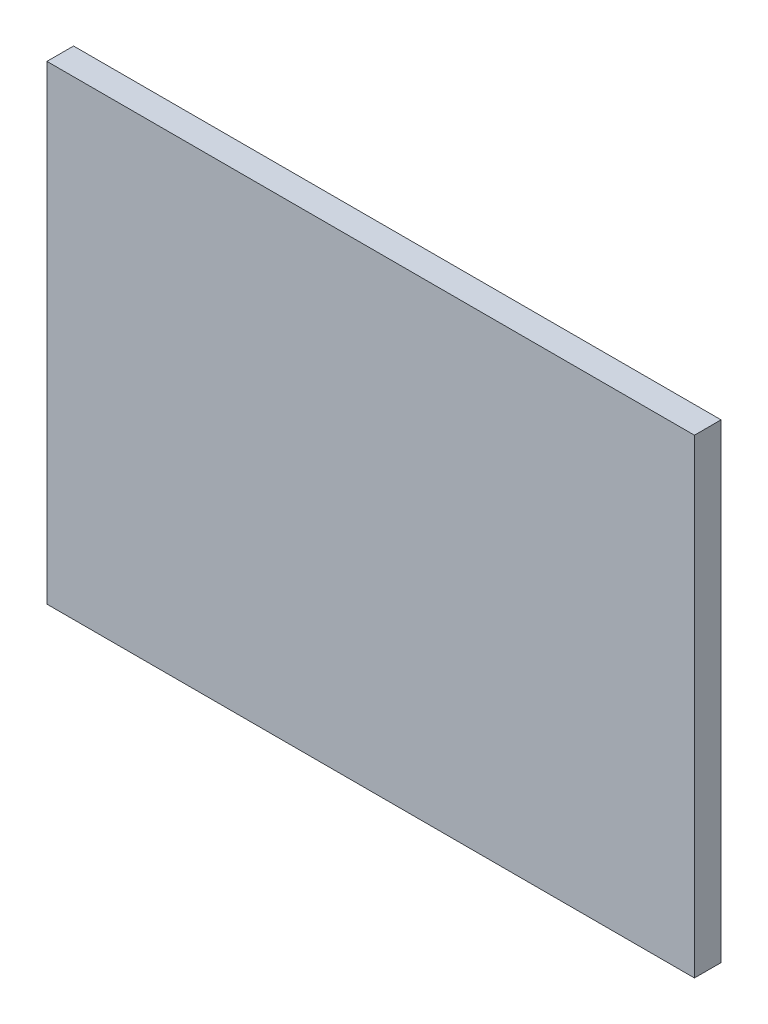
from build123d import *

# Parameters (mm, degrees)
SKETCH1_W           = 73
SKETCH1_H           = 53
BOSS_EXTRUDE1_DEPTH = 3


with BuildPart() as part:
    # Sketch1 → Boss-Extrude1 (new body)
    with BuildSketch(Plane.XY):
        Rectangle(SKETCH1_W, SKETCH1_H)
    extrude(amount=BOSS_EXTRUDE1_DEPTH)


solid = part.part
